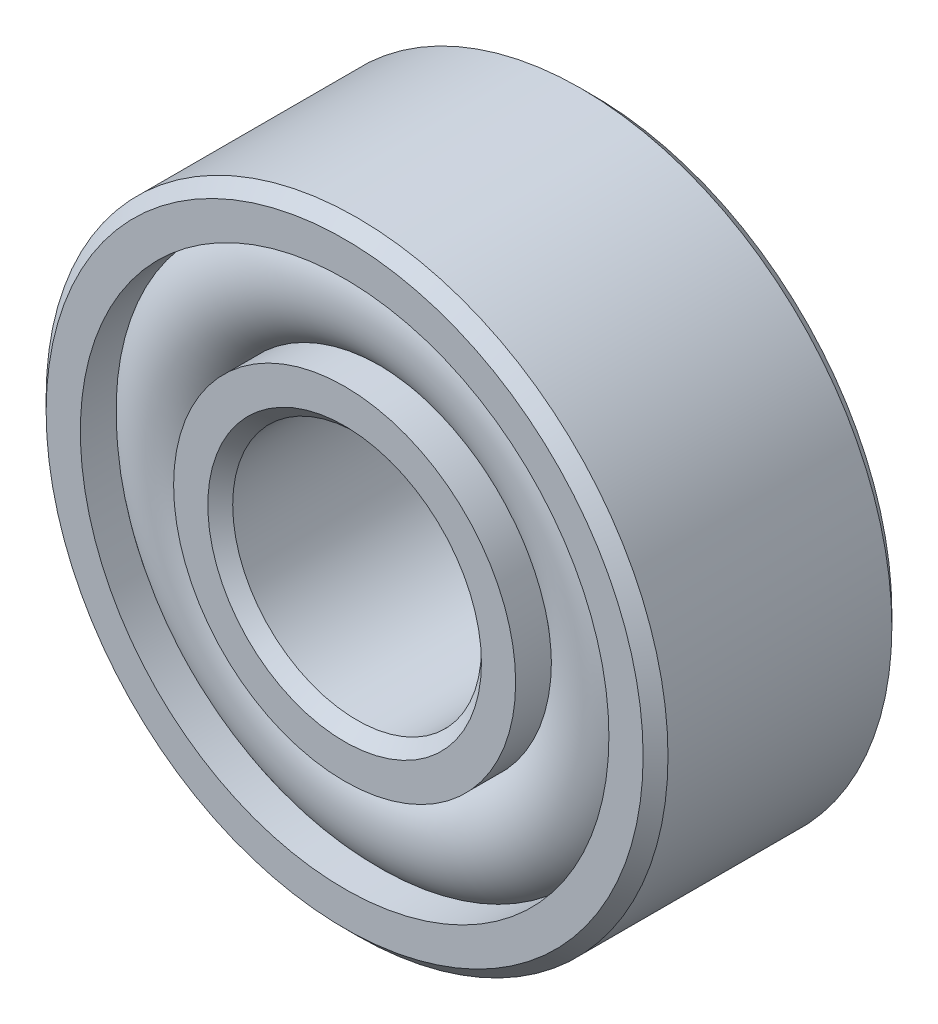
from build123d import *

# Parameters (mm, degrees)
CHAMFER1_SIZE = 0.2
CHAMFER2_SIZE = 0.2
CHAMFER3_SIZE = 0.2
CHAMFER4_SIZE = 0.2


with BuildPart() as part:
    # Sketch1 → Revolve1 (revolve)
    with BuildSketch(Plane(origin=(0, 0, 0), x_dir=(1, 0, 0), z_dir=(0, 1, 0))):
        with BuildLine():
            Line((2.75, 3.424799903), (2.75, 4))
            Line((2.75, 4), (2, 4))
            Line((2, 4), (2, 0))
            Line((2, 0), (2.75, 0))
            Line((2.75, 0), (2.75, 0.575200097))
            ThreePointArc((2.75, 0.575200097), (3.5, 0.25), (4.25, 0.575200097))
            Line((4.25, 0.575200097), (4.25, 0))
            Line((4.25, 0), (5, 0))
            Line((5, 0), (5, 4))
            Line((5, 4), (4.25, 4))
            Line((4.25, 4), (4.25, 3.424799903))
            ThreePointArc((4.25, 3.424799903), (3.5, 3.75), (2.75, 3.424799903))
        make_face()
    revolve(axis=Axis((0, 0, -4), (0, 0, 1)))

    # Chamfer1
    chamfer1_edges = [part.edges().sort_by_distance(p)[0] for p in [
        (-5, 0, -4),
    ]]
    chamfer(chamfer1_edges, length=CHAMFER1_SIZE)

    # Chamfer2
    chamfer2_edges = [part.edges().sort_by_distance(p)[0] for p in [
        (-2, 0, -4),
    ]]
    chamfer(chamfer2_edges, length=CHAMFER2_SIZE)

    # Chamfer3
    chamfer3_edges = [part.edges().sort_by_distance(p)[0] for p in [
        (-5, 0, 0),
    ]]
    chamfer(chamfer3_edges, length=CHAMFER3_SIZE)

    # Chamfer4
    chamfer4_edges = [part.edges().sort_by_distance(p)[0] for p in [
        (-2, 0, 0),
    ]]
    chamfer(chamfer4_edges, length=CHAMFER4_SIZE)


solid = part.part
